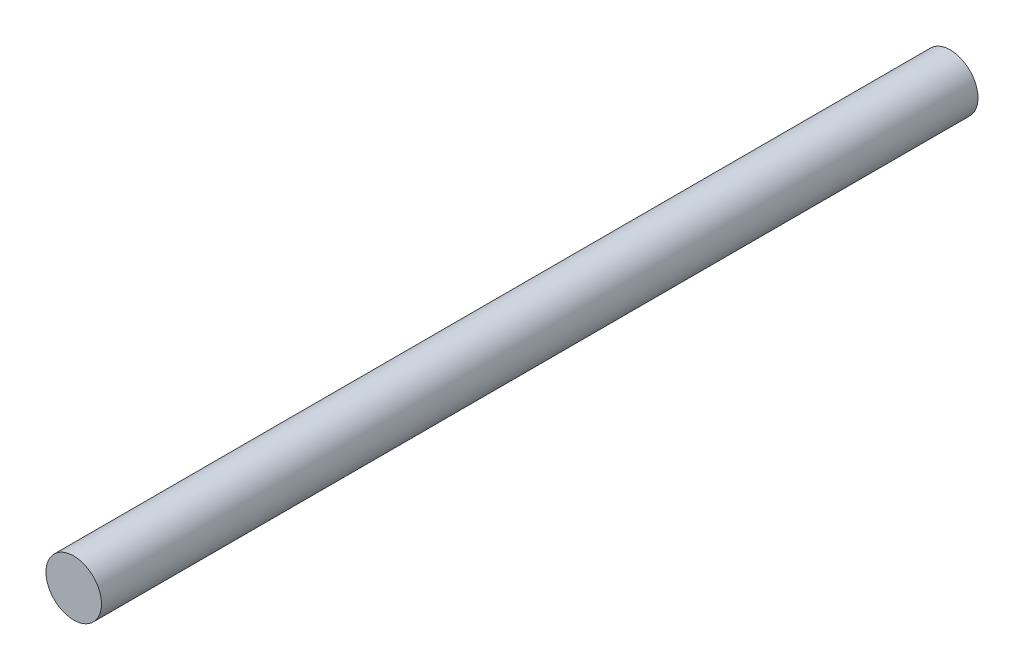
from build123d import *

# Parameters (mm, degrees)
SKETCH_1_R      = 3.8
EXTRUDE_1_DEPTH = 120


with BuildPart() as part:
    # Эскиз1 → Бобышка-Вытянуть1 (new body)
    with BuildSketch(Plane.XY):
        Circle(SKETCH_1_R)
    extrude(amount=EXTRUDE_1_DEPTH)


solid = part.part
